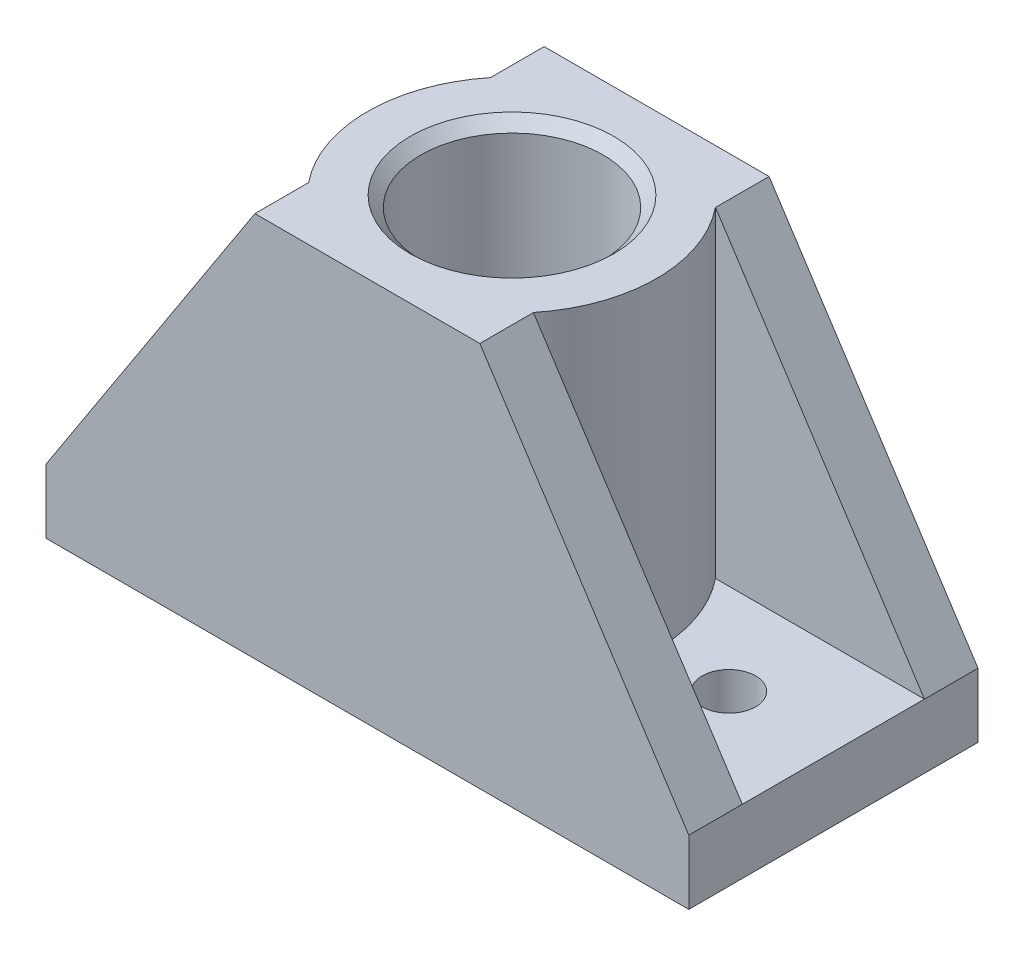
from build123d import *
from OCP.BRepFilletAPI import BRepFilletAPI_MakeChamfer

# Parameters (mm, degrees)
SKETCH1_W           = 60
SKETCH1_H           = 27
BOSS_EXTRUDE1_DEPTH = 6
SKETCH2_R           = 13.5
SKETCH2_R_2         = 8.5
BOSS_EXTRUDE2_DEPTH = 30
SKETCH3_W           = 60
SKETCH3_H           = 5
BOSS_EXTRUDE3_DEPTH = 30
CHAMFER1_SIZE       = 30
CHAMFER1_SIZE2      = 19.5
SKETCH5_R           = 2.5
CUT_EXTRUDE1_DEPTH  = 30
CHAMFER3_SIZE       = 1


with BuildPart() as part:
    # Sketch1 → Boss-Extrude1 (new body)
    with BuildSketch(Plane(origin=(0, 0, 0), x_dir=(1, 0, 0), z_dir=(0, 1, 0))):
        with Locations((-76.040322581, 2.721774194)):
            Rectangle(SKETCH1_W, SKETCH1_H)
    extrude(amount=BOSS_EXTRUDE1_DEPTH)

    # Sketch2 → Boss-Extrude2 (add)
    with BuildSketch(Plane(origin=(0, 6, 0), x_dir=(1, 0, 0), z_dir=(0, 1, 0))):
        with Locations(Location((-76.040322581, 2.721774194, 0), (0, 0, 270))):
            Circle(SKETCH2_R)
        with Locations(Location((-76.040322581, 2.721774194, 0), (0, 0, 270))):
            Circle(SKETCH2_R_2, mode=Mode.SUBTRACT)
    extrude(amount=BOSS_EXTRUDE2_DEPTH)

    # Sketch3 → Boss-Extrude3 (add)
    with BuildSketch(Plane(origin=(0, 6, 0), x_dir=(1, 0, 0), z_dir=(0, 1, 0))):
        with Locations((-76.040322581, 13.721774194)):
            Rectangle(SKETCH3_W, SKETCH3_H)
        with Locations((-76.040322581, -8.278225806)):
            Rectangle(SKETCH3_W, SKETCH3_H)
    extrude(amount=BOSS_EXTRUDE3_DEPTH)

    # Chamfer1: one chamfer whose edges measure the first distance from different faces: ONE call of the kernel's chamfer builder (chamfer() names one face for all edges)
    chamfer1_edges_1 = [part.edges().sort_by_distance(p)[0] for p in [
        (-46.040322581, 36, 8.278225806),
        (-46.040322581, 36, -13.721774194),
    ]]
    chamfer1_side_1 = [part.faces().sort_by_distance(p)[0] for p in [
        (-46.040322581, 18, -15.771774194),
    ]]
    chamfer1_edges_2 = [part.edges().sort_by_distance(p)[0] for p in [
        (-106.040322581, 36, 8.278225806),
        (-106.040322581, 36, -13.721774194),
    ]]
    chamfer1_side_2 = [part.faces().sort_by_distance(p)[0] for p in [
        (-106.040322581, 18, 10.328225806),
    ]]
    chamfer1 = BRepFilletAPI_MakeChamfer(part.part.solid().wrapped)
    for e in chamfer1_edges_1:
        chamfer1.Add(CHAMFER1_SIZE, CHAMFER1_SIZE2, e.wrapped, chamfer1_side_1[0].wrapped)  # the first distance lies on this face
    for e in chamfer1_edges_2:
        chamfer1.Add(CHAMFER1_SIZE, CHAMFER1_SIZE2, e.wrapped, chamfer1_side_2[0].wrapped)  # the first distance lies on this face
    add(Compound.cast(chamfer1.Shape()), mode=Mode.REPLACE)

    # Sketch5 → Cut-Extrude1 (cut)
    with BuildSketch(Plane(origin=(0, 6, 0), x_dir=(1, 0, 0), z_dir=(0, 1, 0))):
        with Locations(Location((-96.284366821, 2.721774194, 0), (0, 0, 270))):
            Circle(SKETCH5_R)
        with Locations(Location((-55.79627834, 2.721774194, 0), (0, 0, 270))):
            Circle(SKETCH5_R)
    extrude(amount=-CUT_EXTRUDE1_DEPTH, mode=Mode.SUBTRACT)

    # Chamfer3
    chamfer3_edges = [part.edges().sort_by_distance(p)[0] for p in [
        (-76.040322581, 36, -11.221774194),
    ]]
    chamfer(chamfer3_edges, length=CHAMFER3_SIZE)


solid = part.part
